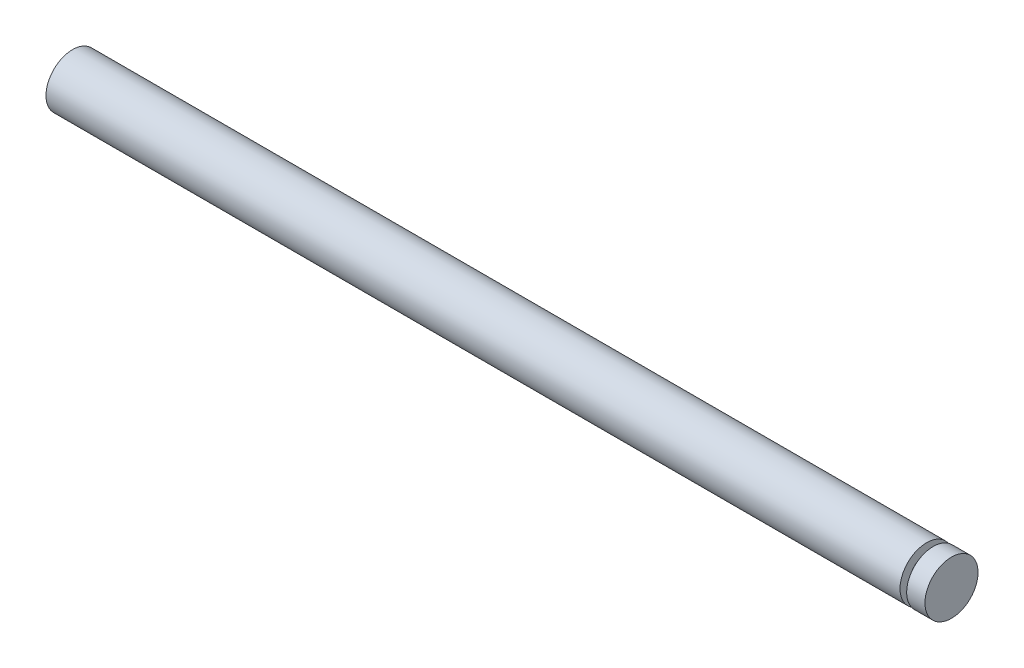
from build123d import *

# Parameters (mm, degrees)
SKETCH1_R           = 18.415
BOSS_EXTRUDE1_DEPTH = 609.6
SKETCH2_W           = 4.572
SKETCH2_H           = 6.35


with BuildPart() as part:
    # Sketch1 → Boss-Extrude1 (new body)
    with BuildSketch(Plane(origin=(0, 0, 0), x_dir=(0, 0, -1), z_dir=(1, 0, 0))):
        with Locations(Location((0, 0, 0), (0, 0, 180))):
            Circle(SKETCH1_R)
    extrude(amount=BOSS_EXTRUDE1_DEPTH)

    # Sketch2 → Cut-Revolve1 (revolve, cut)
    with BuildSketch(Plane.XY, mode=Mode.PRIVATE) as cut_revolve1_sk:
        with Locations((594.614, 15.24)):
            Rectangle(SKETCH2_W, SKETCH2_H)
    revolve(cut_revolve1_sk.sketch.rotate(Axis((611.915821956, 0, 0), (-1, 0, 0)), 270), axis=Axis((611.915821956, 0, 0), (-1, 0, 0)), mode=Mode.SUBTRACT)


solid = part.part
